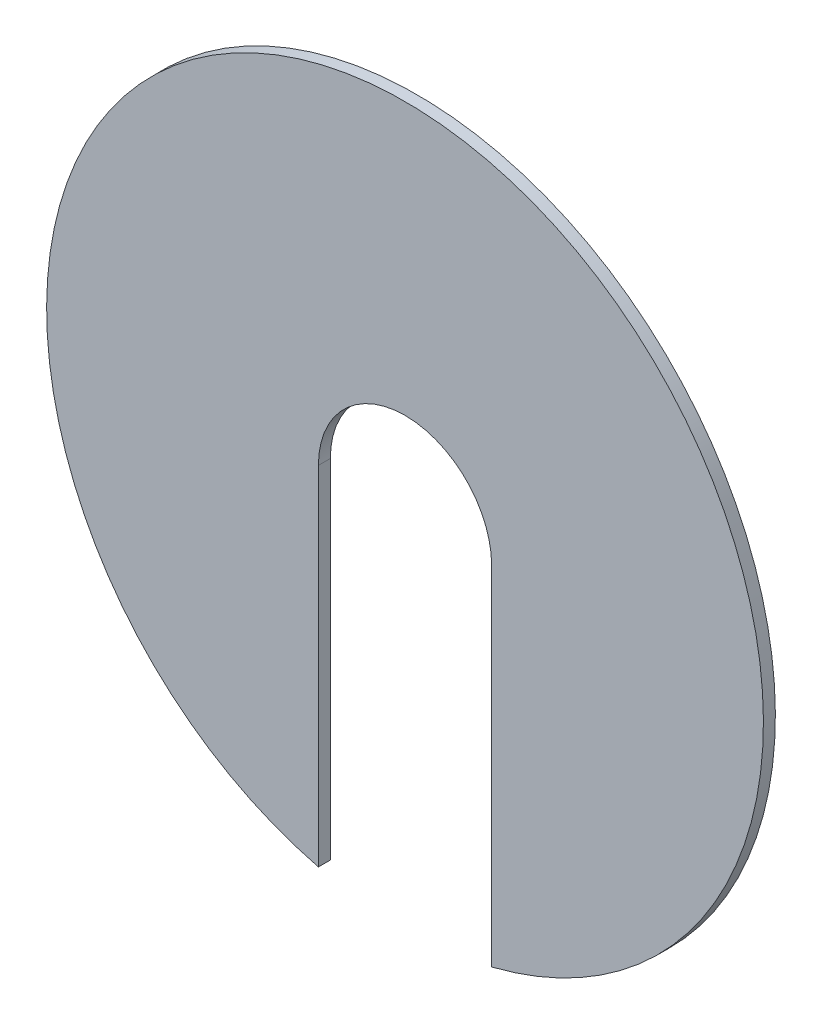
from build123d import *

# Parameters (mm, degrees)
BOSS_EXTRUDE1_DEPTH = 0.5


with BuildPart() as part:
    # Sketch1 → Boss-Extrude1 (new, symmetric)
    with BuildSketch(Plane.XY):
        with BuildLine():
            Line((-7.25, 0), (-7.25, -29.11077979))
            ThreePointArc((-7.25, -29.11077979), (0, 30), (7.25, -29.11077979))
            Line((7.25, -29.11077979), (7.25, 0))
            ThreePointArc((7.25, 0), (0, 7.25), (-7.25, 0))
        make_face()
    extrude(amount=BOSS_EXTRUDE1_DEPTH, both=True)


solid = part.part
